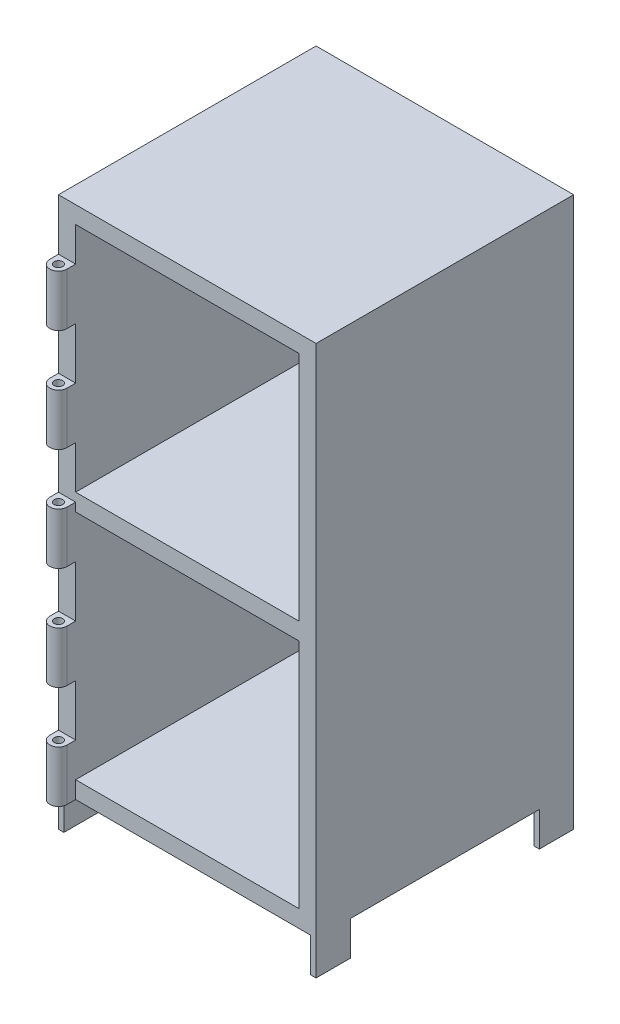
from build123d import *

# Parameters (mm, degrees)
SKETCH1_W           = 150
SKETCH1_H           = 150
BOSS_EXTRUDE1_DEPTH = 300
SKETCH2_W           = 130
SKETCH2_H           = 135
CUT_EXTRUDE1_DEPTH  = 130
SKETCH3_W           = 10
SKETCH3_H           = 30
BOSS_EXTRUDE2_DEPTH = 10
SKETCH4_R           = 2.5
CUT_EXTRUDE2_DEPTH  = 344.365694268
FILLET1_RADIUS      = 5
FILLET1_LENGTH      = 30
FILLET2_RADIUS      = 5
FILLET2_LENGTH      = 30
FILLET3_RADIUS      = 5
FILLET3_LENGTH      = 30
FILLET4_RADIUS      = 5
FILLET4_LENGTH      = 30
FILLET5_RADIUS      = 5
FILLET5_LENGTH      = 30
SKETCH5_W           = 3.175
SKETCH5_H           = 20
BOSS_EXTRUDE3_DEPTH = 20


with BuildPart() as part:
    # Sketch1 → Boss-Extrude1 (new body)
    with BuildSketch(Plane(origin=(0, 0, 0), x_dir=(1, 0, 0), z_dir=(0, 1, 0))):
        with Locations((75, 75)):
            Rectangle(SKETCH1_W, SKETCH1_H)
    extrude(amount=BOSS_EXTRUDE1_DEPTH)

    # Sketch2 → Cut-Extrude1 (cut)
    with BuildSketch(Plane.XY):
        with Locations((75, 77.5)):
            Rectangle(SKETCH2_W, SKETCH2_H)
        with Locations((75, 222.5)):
            Rectangle(SKETCH2_W, SKETCH2_H)
    extrude(amount=-CUT_EXTRUDE1_DEPTH, mode=Mode.SUBTRACT)

    # Sketch3 → Boss-Extrude2 (add)
    with BuildSketch(Plane.ZY):
        with Locations((5, 75)):
            Rectangle(SKETCH3_W, SKETCH3_H)
        with Locations((5, 15)):
            Rectangle(SKETCH3_W, SKETCH3_H)
        with Locations((5, 135)):
            Rectangle(SKETCH3_W, SKETCH3_H)
        with Locations((5, 195)):
            Rectangle(SKETCH3_W, SKETCH3_H)
        with Locations((5, 255)):
            Rectangle(SKETCH3_W, SKETCH3_H)
    extrude(amount=-BOSS_EXTRUDE2_DEPTH)

    # Sketch4 → Cut-Extrude2 (cut, through all)
    with BuildSketch(Plane(origin=(0, 270, 0), x_dir=(1, 0, 0), z_dir=(0, 1, 0))):
        with Locations(Location((5, -5, 0), (0, 0, 270))):
            Circle(SKETCH4_R)
    extrude(amount=-CUT_EXTRUDE2_DEPTH, mode=Mode.SUBTRACT)

    # Fillet1: full round fillet: the end face becomes a half cylinder, R = half its width
    fillet1_face = Plane((5, 255, 10), x_dir=(0, 1, 0), z_dir=(0, 0, 1))  # on the end face: x along it, z out of the body
    fillet1_slab = fillet1_face.offset(-FILLET1_RADIUS / 2) * Box(FILLET1_LENGTH, 2 * FILLET1_RADIUS, FILLET1_RADIUS, mode=Mode.PRIVATE)  # the body's end, R deep
    fillet1_round = Plane((5, 255, 5), x_dir=(0, 0, 1), z_dir=(0, 1, 0)) * Cylinder(FILLET1_RADIUS, FILLET1_LENGTH, mode=Mode.PRIVATE)  # its axis R under the face
    add(fillet1_slab - fillet1_round, mode=Mode.SUBTRACT)

    # Fillet2: full round fillet: the end face becomes a half cylinder, R = half its width
    fillet2_face = Plane((5, 195, 10), x_dir=(0, 1, 0), z_dir=(0, 0, 1))  # on the end face: x along it, z out of the body
    fillet2_slab = fillet2_face.offset(-FILLET2_RADIUS / 2) * Box(FILLET2_LENGTH, 2 * FILLET2_RADIUS, FILLET2_RADIUS, mode=Mode.PRIVATE)  # the body's end, R deep
    fillet2_round = Plane((5, 195, 5), x_dir=(0, 0, 1), z_dir=(0, 1, 0)) * Cylinder(FILLET2_RADIUS, FILLET2_LENGTH, mode=Mode.PRIVATE)  # its axis R under the face
    add(fillet2_slab - fillet2_round, mode=Mode.SUBTRACT)

    # Fillet3: full round fillet: the end face becomes a half cylinder, R = half its width
    fillet3_face = Plane((5, 135, 10), x_dir=(0, 1, 0), z_dir=(0, 0, 1))  # on the end face: x along it, z out of the body
    fillet3_slab = fillet3_face.offset(-FILLET3_RADIUS / 2) * Box(FILLET3_LENGTH, 2 * FILLET3_RADIUS, FILLET3_RADIUS, mode=Mode.PRIVATE)  # the body's end, R deep
    fillet3_round = Plane((5, 135, 5), x_dir=(0, 0, 1), z_dir=(0, 1, 0)) * Cylinder(FILLET3_RADIUS, FILLET3_LENGTH, mode=Mode.PRIVATE)  # its axis R under the face
    add(fillet3_slab - fillet3_round, mode=Mode.SUBTRACT)

    # Fillet4: full round fillet: the end face becomes a half cylinder, R = half its width
    fillet4_face = Plane((5, 75, 10), x_dir=(0, 1, 0), z_dir=(0, 0, 1))  # on the end face: x along it, z out of the body
    fillet4_slab = fillet4_face.offset(-FILLET4_RADIUS / 2) * Box(FILLET4_LENGTH, 2 * FILLET4_RADIUS, FILLET4_RADIUS, mode=Mode.PRIVATE)  # the body's end, R deep
    fillet4_round = Plane((5, 75, 5), x_dir=(0, 0, 1), z_dir=(0, 1, 0)) * Cylinder(FILLET4_RADIUS, FILLET4_LENGTH, mode=Mode.PRIVATE)  # its axis R under the face
    add(fillet4_slab - fillet4_round, mode=Mode.SUBTRACT)

    # Fillet5: full round fillet: the end face becomes a half cylinder, R = half its width
    fillet5_face = Plane((5, 15, 10), x_dir=(0, 1, 0), z_dir=(0, 0, 1))  # on the end face: x along it, z out of the body
    fillet5_slab = fillet5_face.offset(-FILLET5_RADIUS / 2) * Box(FILLET5_LENGTH, 2 * FILLET5_RADIUS, FILLET5_RADIUS, mode=Mode.PRIVATE)  # the body's end, R deep
    fillet5_round = Plane((5, 15, 5), x_dir=(0, 0, 1), z_dir=(0, 1, 0)) * Cylinder(FILLET5_RADIUS, FILLET5_LENGTH, mode=Mode.PRIVATE)  # its axis R under the face
    add(fillet5_slab - fillet5_round, mode=Mode.SUBTRACT)

    # Sketch5 → Boss-Extrude3 (add)
    with BuildSketch(Plane.XZ):
        with Locations((1.5875, -140)):
            Rectangle(SKETCH5_W, SKETCH5_H)
        with Locations((1.5875, -10)):
            Rectangle(SKETCH5_W, SKETCH5_H)
        with Locations((148.4125, -10)):
            Rectangle(SKETCH5_W, SKETCH5_H)
        with Locations((148.4125, -140)):
            Rectangle(SKETCH5_W, SKETCH5_H)
    extrude(amount=BOSS_EXTRUDE3_DEPTH)


solid = part.part
